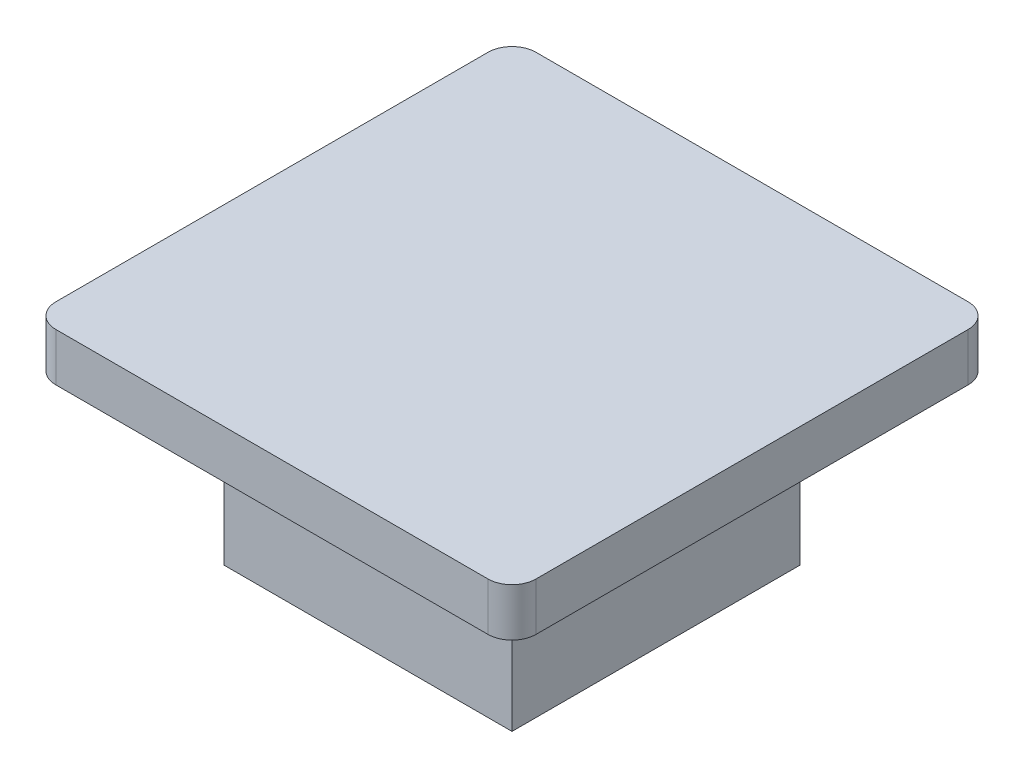
from build123d import *

# Parameters (mm, degrees)
SKETCH1_W           = 200
SKETCH1_H           = 200
BOSS_EXTRUDE1_DEPTH = 20
SKETCH3_W           = 120
SKETCH3_H           = 120
BOSS_EXTRUDE2_DEPTH = 70
CUT_EXTRUDE1_DEPTH  = 20
SKETCH5_R           = 16
SKETCH5_R_2         = 11
CUT_EXTRUDE2_DEPTH  = 10
FILLET1_R           = 10
FILLET4_R           = 10


with BuildPart() as part:
    # Sketch1 → Boss-Extrude1 (new body)
    with BuildSketch(Plane(origin=(0, 0, 0), x_dir=(1, 0, 0), z_dir=(0, 1, 0))):
        Rectangle(SKETCH1_W, SKETCH1_H)
    extrude(amount=BOSS_EXTRUDE1_DEPTH)

    # Sketch3 → Boss-Extrude2 (add)
    with BuildSketch(Plane.XZ):
        Rectangle(SKETCH3_W, SKETCH3_H)
    extrude(amount=BOSS_EXTRUDE2_DEPTH)

    # Sketch4 → Cut-Extrude1 (cut)
    with BuildSketch(Plane.XZ.offset(70)):
        with BuildLine():
            Line((3.647893136, 28.937904965), (30.991643136, 10.334966059))
            ThreePointArc((30.991643136, 10.334966059), (36.460393136, 0), (30.991643136, -10.334966059))
            Line((30.991643136, -10.334966059), (3.647893136, -28.937904965))
            ThreePointArc((3.647893136, -28.937904965), (-51.039606864, 0), (3.647893136, 28.937904965))
        make_face()
    extrude(amount=-CUT_EXTRUDE1_DEPTH, mode=Mode.SUBTRACT)

    # Sketch5 → Cut-Extrude2 (cut)
    with BuildSketch(Plane.XZ.offset(50)):
        with Locations(Location((-16.039606864, 0, 0), (0, 0, 270))):
            Circle(SKETCH5_R)
        with Locations(Location((23.960393136, 0, 0), (0, 0, 270))):
            Circle(SKETCH5_R_2)
    extrude(amount=-CUT_EXTRUDE2_DEPTH, mode=Mode.SUBTRACT)

    # Fillet1
    fillet1_edges = [part.edges().sort_by_distance(p)[0] for p in [
        (100, 10, 100),
        (-100, 10, 100),
        (-100, 10, -100),
        (100, 10, -100),
    ]]
    fillet(fillet1_edges, radius=FILLET1_R)

    # Fillet4
    fillet4_edges = [part.edges().sort_by_distance(p)[0] for p in [
        (60, 0, 0),
        (0, 0, 60),
        (-60, 0, 0),
        (0, 0, -60),
    ]]
    fillet(fillet4_edges, radius=FILLET4_R)


solid = part.part
